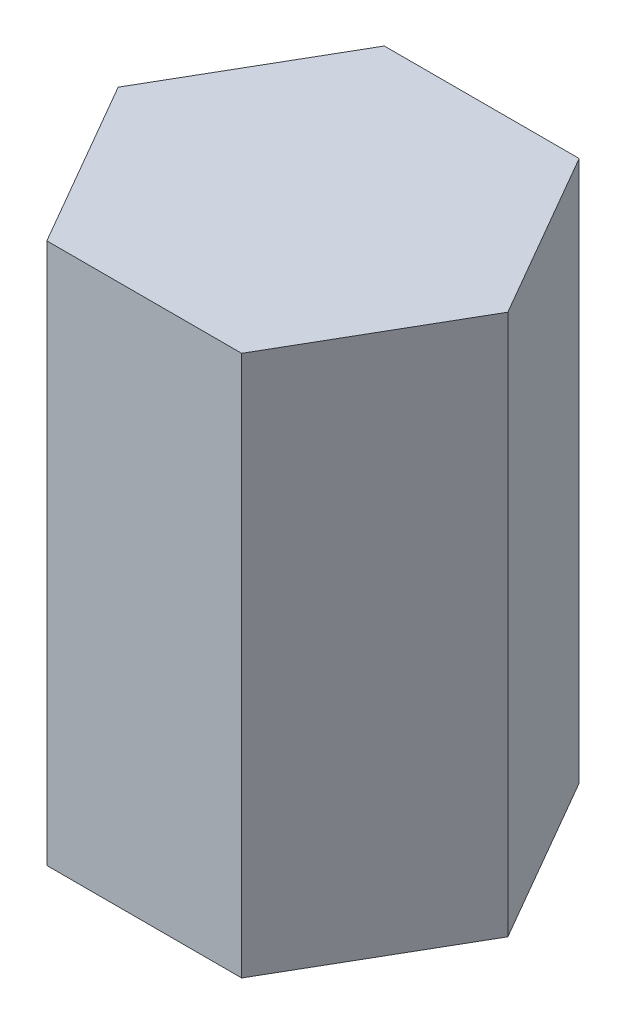
from build123d import *

# Parameters (mm, degrees)
BOSS_EXTRUDE1_DEPTH = 1603
CUT_EXTRUDE1_DEPTH  = 1200.3


with BuildPart() as part:
    # Sketch2 → Boss-Extrude1 (new body)
    with BuildSketch(Plane(origin=(0, 0, 0), x_dir=(1, 0, 0), z_dir=(0, 1, 0))):
        Polygon((577.35026919, 0), (288.675134595, 500), (-288.675134595, 500), (-577.35026919, 0), (-288.675134595, -500), (288.675134595, -500), align=None)
    extrude(amount=BOSS_EXTRUDE1_DEPTH)

    # Sketch3 → Cut-Extrude1 (cut)
    with BuildSketch(Plane(origin=(0, 400.75, 0), x_dir=(1, 0, 0), z_dir=(0, 1, 0))):
        Polygon((575.040868113, 0), (287.520434056, 498), (-287.520434056, 498), (-575.040868113, 0), (-287.520434056, -498), (287.520434056, -498), align=None)
    extrude(amount=CUT_EXTRUDE1_DEPTH, mode=Mode.SUBTRACT)


solid = part.part
